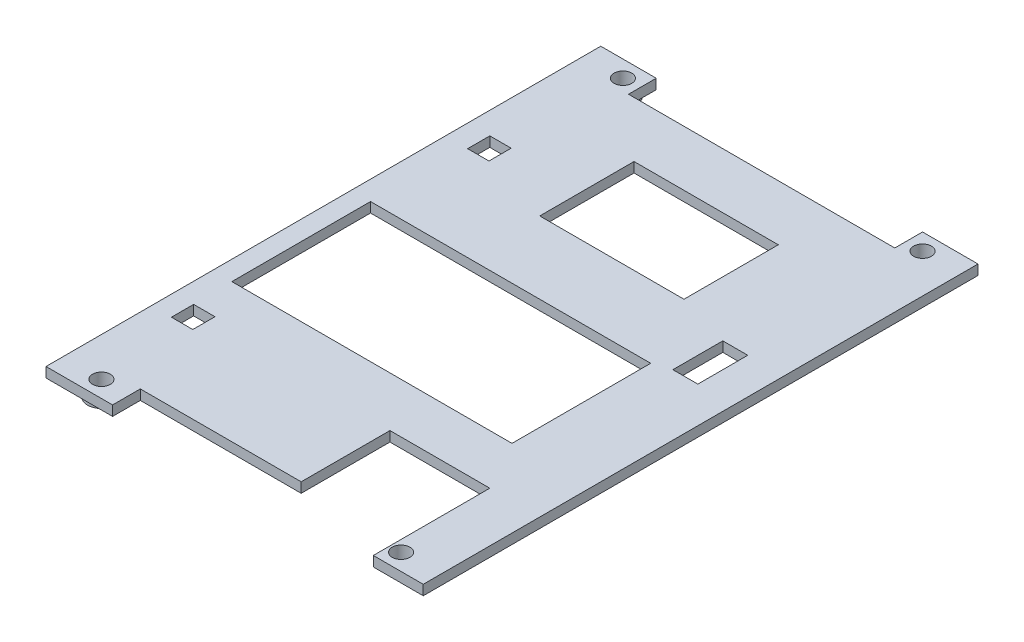
from build123d import *

# Parameters (mm, degrees)
SKETCH_1_W          = 68
SKETCH_1_H          = 100
EXTRUDE_1_DEPTH     = 1.8
SKETCH_2_W          = 48
SKETCH_2_H          = 5
SKETCH_2_W_2        = 26
SKETCH_2_H_2        = 17
SKETCH_2_W_3        = 3.846350714
SKETCH_2_H_3        = 4
SKETCH_2_W_4        = 50.5
SKETCH_2_H_4        = 25
SKETCH_2_W_5        = 24
SKETCH_2_W_6        = 18
SKETCH_2_H_5        = 16.79174546
SKETCH_2_W_7        = 4.5
SKETCH_2_H_6        = 9
CUT_EXTRUDE_1_DEPTH = 1.8
SKETCH_4_R          = 2.5
SKETCH_4_R_2        = 1.4
SKETCH_4_R_3        = 2
EXTRUDE_3_DEPTH     = 1
CUT_EXTRUDE_START   = -14
SKETCH_6_R          = 1.4
CUT_EXTRUDE_3_DEPTH = 14
SKETCH_8_W          = 5
SKETCH_8_H          = 5
SKETCH_8_W_2        = 18
SKETCH_8_H_2        = 4.20825454
CUT_EXTRUDE_4_DEPTH = 10
SKETCH_9_R          = 1.6
CUT_EXTRUDE_5_DEPTH = 10


with BuildPart() as part:
    # 草图1 → 凸台-拉伸1 (new body)
    with BuildSketch(Plane(origin=(0, 0, 0), x_dir=(1, 0, 0), z_dir=(0, 1, 0))):
        with Locations((34, -50)):
            Rectangle(SKETCH_1_W, SKETCH_1_H)
    extrude(amount=EXTRUDE_1_DEPTH)

    # 草图2 → 切除-拉伸1 (cut)
    with BuildSketch(Plane(origin=(0, 1.8, 0), x_dir=(1, 0, 0), z_dir=(0, 1, 0))):
        with Locations((34, -2.5)):
            Rectangle(SKETCH_2_W, SKETCH_2_H)
        with Locations((34, -23.5)):
            Rectangle(SKETCH_2_W_2, SKETCH_2_H_2)
        with Locations((5.923175357, -26)):
            Rectangle(SKETCH_2_W_3, SKETCH_2_H_3)
        with Locations((5.535050967, -79)):
            Rectangle(SKETCH_2_W_3, SKETCH_2_H_3)
        with Locations((28.75, -57.5)):
            Rectangle(SKETCH_2_W_4, SKETCH_2_H_4)
        with Locations((24, -97.5)):
            Rectangle(SKETCH_2_W_5, SKETCH_2_H)
        with Locations((50, -91.60412727)):
            Rectangle(SKETCH_2_W_6, SKETCH_2_H_5)
        with Locations((59.25, -39.5)):
            Rectangle(SKETCH_2_W_7, SKETCH_2_H_6)
    extrude(amount=-CUT_EXTRUDE_1_DEPTH, mode=Mode.SUBTRACT)

    # 草图4 → 凸台-拉伸3 (add)
    # profile 1 of 4: a face of its own
    with BuildSketch(Plane.XZ):
        with Locations(Location((7, 97, 0), (0, 0, 90))):
            Circle(SKETCH_4_R)
        with Locations(Location((7, 97, 0), (0, 0, 270))):
            Circle(SKETCH_4_R_2, mode=Mode.SUBTRACT)
    # profile 2 of 4: a face of its own
    with BuildSketch(Plane.XZ):
        with Locations(Location((61, 97, 0), (0, 0, 180))):
            Circle(SKETCH_4_R_3)
        with Locations(Location((61, 97, 0), (0, 0, 270))):
            Circle(SKETCH_4_R_2, mode=Mode.SUBTRACT)
    # profile 3 of 4: a face of its own
    with BuildSketch(Plane.XZ):
        with Locations(Location((61, 3, 0), (0, 0, 90))):
            Circle(SKETCH_4_R)
        with Locations(Location((61, 3, 0), (0, 0, 270))):
            Circle(SKETCH_4_R_2, mode=Mode.SUBTRACT)
    # profile 4 of 4: a face of its own
    with BuildSketch(Plane.XZ):
        with Locations(Location((7, 3, 0), (0, 0, 90))):
            Circle(SKETCH_4_R)
        with Locations(Location((7, 3, 0), (0, 0, 270))):
            Circle(SKETCH_4_R_2, mode=Mode.SUBTRACT)
    extrude(amount=EXTRUDE_3_DEPTH)

    # 草图6 → 切除-拉伸3 (cut)
    with BuildSketch(Plane.XZ.offset(CUT_EXTRUDE_START)):
        with Locations(Location((7, 97, 0), (0, 0, 90))):
            Circle(SKETCH_6_R)
        with Locations(Location((61, 97, 0), (0, 0, 90))):
            Circle(SKETCH_6_R)
        with Locations(Location((61, 3, 0), (0, 0, 90))):
            Circle(SKETCH_6_R)
        with Locations(Location((7, 3, 0), (0, 0, 90))):
            Circle(SKETCH_6_R)
    extrude(amount=CUT_EXTRUDE_3_DEPTH, mode=Mode.SUBTRACT)

    # 草图8 → 切除-拉伸4 (cut)
    with BuildSketch(Plane(origin=(0, 1.8, 0), x_dir=(1, 0, 0), z_dir=(0, 1, 0))):
        with Locations((38.5, -97.5)):
            Rectangle(SKETCH_8_W, SKETCH_8_H)
        with Locations((50, -81.10412727)):
            Rectangle(SKETCH_8_W_2, SKETCH_8_H_2)
    extrude(amount=-CUT_EXTRUDE_4_DEPTH, mode=Mode.SUBTRACT)

    # 草图9 → 切除-拉伸5 (cut)
    with BuildSketch(Plane(origin=(0, 1.8, 0), x_dir=(1, 0, 0), z_dir=(0, 1, 0))):
        with Locations(Location((7, -3, 0), (0, 0, 270))):
            Circle(SKETCH_9_R)
        with Locations(Location((61, -3, 0), (0, 0, 270))):
            Circle(SKETCH_9_R)
        with Locations(Location((61, -97, 0), (0, 0, 270))):
            Circle(SKETCH_9_R)
        with Locations(Location((7, -97, 0), (0, 0, 270))):
            Circle(SKETCH_9_R)
    extrude(amount=-CUT_EXTRUDE_5_DEPTH, mode=Mode.SUBTRACT)


solid = part.part
